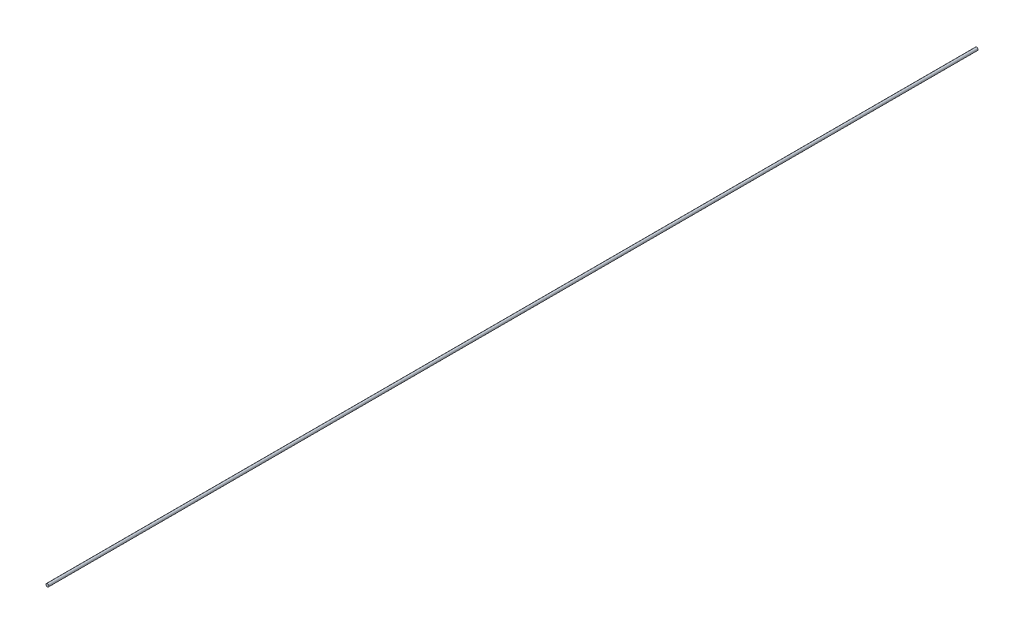
from build123d import *

# Parameters (mm, degrees)
SKETCH1_R           = 0.1
BOSS_EXTRUDE1_DEPTH = 65


with BuildPart() as part:
    # Sketch1 → Boss-Extrude1 (new body)
    with BuildSketch(Plane.XY):
        Circle(SKETCH1_R)
    extrude(amount=BOSS_EXTRUDE1_DEPTH)


solid = part.part
